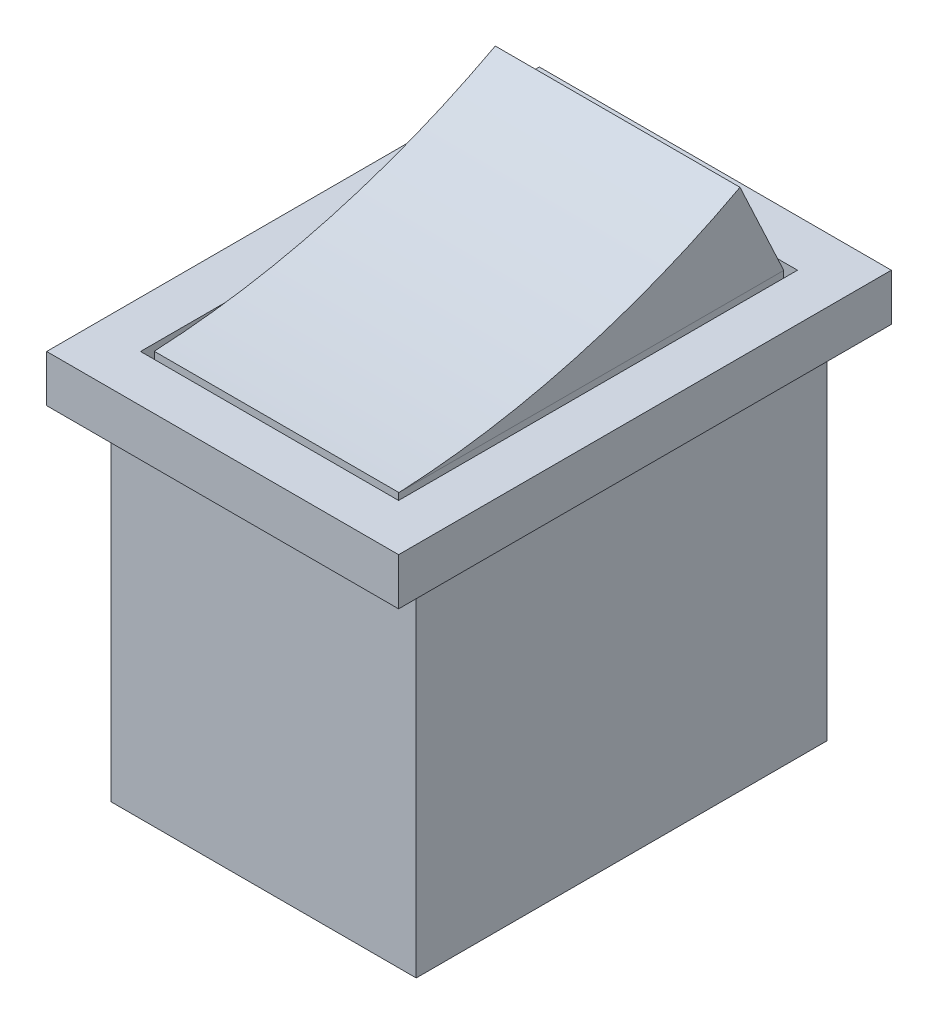
from build123d import *

# Parameters (mm, degrees)
SKETCH_1_W          = 13
SKETCH_1_H          = 17.5
EXTRUDE_1_DEPTH     = 15
SKETCH_2_W          = 15
SKETCH_2_H          = 21
EXTRUDE_2_DEPTH     = 2
SKETCH_3_W          = 11
SKETCH_3_H          = 17
SKETCH_3_W_2        = 10.4
SKETCH_3_H_2        = 16.4
CUT_EXTRUDE_1_DEPTH = 3
EXTRUDE_3_DEPTH     = 5.215


with BuildPart() as part:
    # 草图1 → 凸台-拉伸1 (new body)
    with BuildSketch(Plane(origin=(0, 0, 0), x_dir=(1, 0, 0), z_dir=(0, 1, 0))):
        Rectangle(SKETCH_1_W, SKETCH_1_H)
    extrude(amount=EXTRUDE_1_DEPTH)

    # 草图2 → 凸台-拉伸2 (add)
    with BuildSketch(Plane(origin=(0, 15, 0), x_dir=(1, 0, 0), z_dir=(0, 1, 0))):
        Rectangle(SKETCH_2_W, SKETCH_2_H)
    extrude(amount=EXTRUDE_2_DEPTH)

    # 草图3 → 切除-拉伸1 (cut)
    with BuildSketch(Plane(origin=(0, 17, 0), x_dir=(1, 0, 0), z_dir=(0, 1, 0))):
        Rectangle(SKETCH_3_W, SKETCH_3_H)
        Rectangle(SKETCH_3_W_2, SKETCH_3_H_2, mode=Mode.SUBTRACT)
    extrude(amount=-CUT_EXTRUDE_1_DEPTH, mode=Mode.SUBTRACT)


with BuildPart() as body_2:
    # 草图4 → 凸台-拉伸3 (new, symmetric)
    with BuildSketch(Plane(origin=(0, 0, 0), x_dir=(0, 0, -1), z_dir=(1, 0, 0))):
        with BuildLine():
            Line((8.2, 17), (6.334769367, 21))
            ThreePointArc((6.334769367, 21), (-0.710956487, 18.194560008), (-8.2, 17))
            Line((-8.2, 17), (8.2, 17))
        make_face()
    extrude(amount=EXTRUDE_3_DEPTH, both=True)


solid = Compound([part.part, body_2.part])
